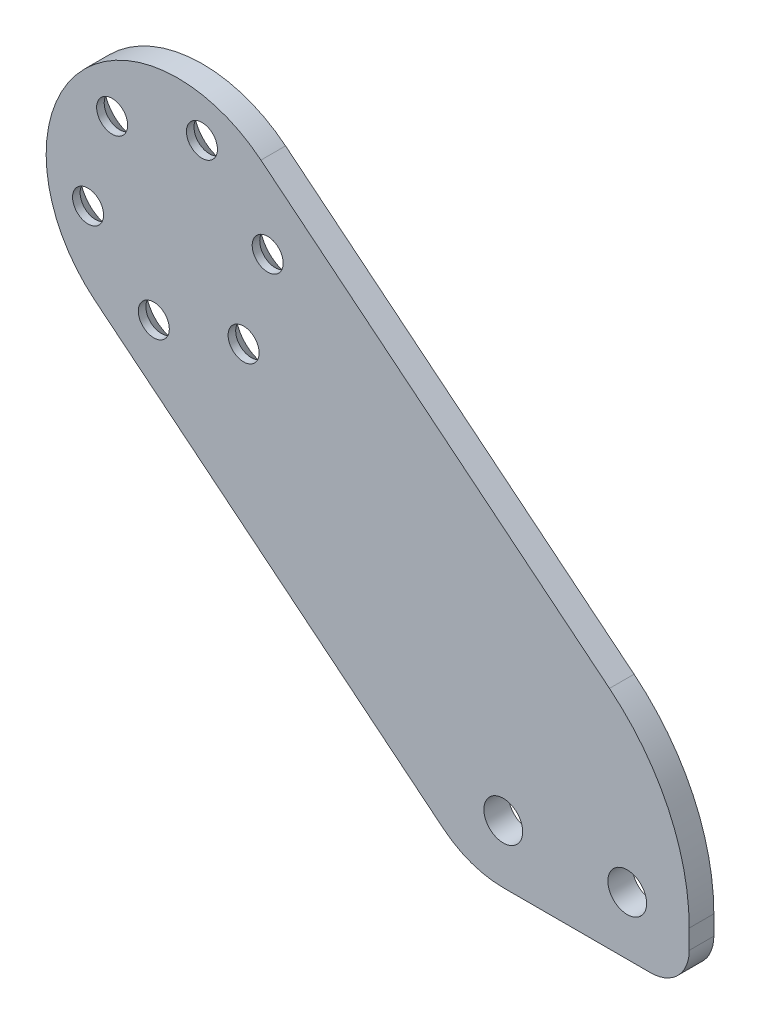
from build123d import *

# Parameters (mm, degrees)
SKETCH1_R           = 2
SKETCH1_R_2         = 2.5
BOSS_EXTRUDE1_DEPTH = 3.175
FILLET1_R           = 5
CHAMFER1_SIZE       = 2.2


with BuildPart() as part:
    # Sketch1 → Boss-Extrude1 (new body)
    with BuildSketch(Plane.XY):
        with BuildLine():
            Line((34.261326859, -49.751843123), (-10.721932331, -13.1924284))
            ThreePointArc((-10.721932331, -13.1924284), (-13.1924284, 10.721932331), (10.721932331, 13.1924284))
            Line((10.721932331, 13.1924284), (55.705191521, -23.366986323))
            ThreePointArc((55.705191521, -23.366986323), (63.295065064, -33.021160716), (66, -45))
            Line((66, -45), (66, -52.5))
            Line((66, -52.5), (42, -52.5))
            ThreePointArc((42, -52.5), (37.893924373, -51.792566974), (34.261326859, -49.751843123))
        make_face()
        with Locations((-8.485281374, 8.485281374)):
            Circle(SKETCH1_R, mode=Mode.SUBTRACT)
        with Locations((3.105828541, 11.591109915)):
            Circle(SKETCH1_R, mode=Mode.SUBTRACT)
        with Locations((11.591109915, 3.105828541)):
            Circle(SKETCH1_R, mode=Mode.SUBTRACT)
        with Locations((8.485281374, -8.485281374)):
            Circle(SKETCH1_R, mode=Mode.SUBTRACT)
        with Locations((42, -45)):
            Circle(SKETCH1_R_2, mode=Mode.SUBTRACT)
        with Locations((58, -45)):
            Circle(SKETCH1_R_2, mode=Mode.SUBTRACT)
        with Locations((-3.105828541, -11.591109915)):
            Circle(SKETCH1_R, mode=Mode.SUBTRACT)
        with Locations((-11.591109915, -3.105828541)):
            Circle(SKETCH1_R, mode=Mode.SUBTRACT)
    extrude(amount=BOSS_EXTRUDE1_DEPTH)

    # Fillet1
    fillet1_edges = [part.edges().sort_by_distance(p)[0] for p in [
        (66, -52.5, 1.5875),
    ]]
    fillet(fillet1_edges, radius=FILLET1_R)

    # Chamfer1
    chamfer1_edges = [part.edges().sort_by_distance(p)[0] for p in [
        (-10.485281374, 8.485281374, 0),
        (1.105828541, 11.591109915, 0),
        (9.591109915, 3.105828541, 0),
        (6.485281374, -8.485281374, 0),
        (-5.105828541, -11.591109915, 0),
        (-13.591109915, -3.105828541, 0),
    ]]
    chamfer(chamfer1_edges, length=CHAMFER1_SIZE)


solid = part.part
